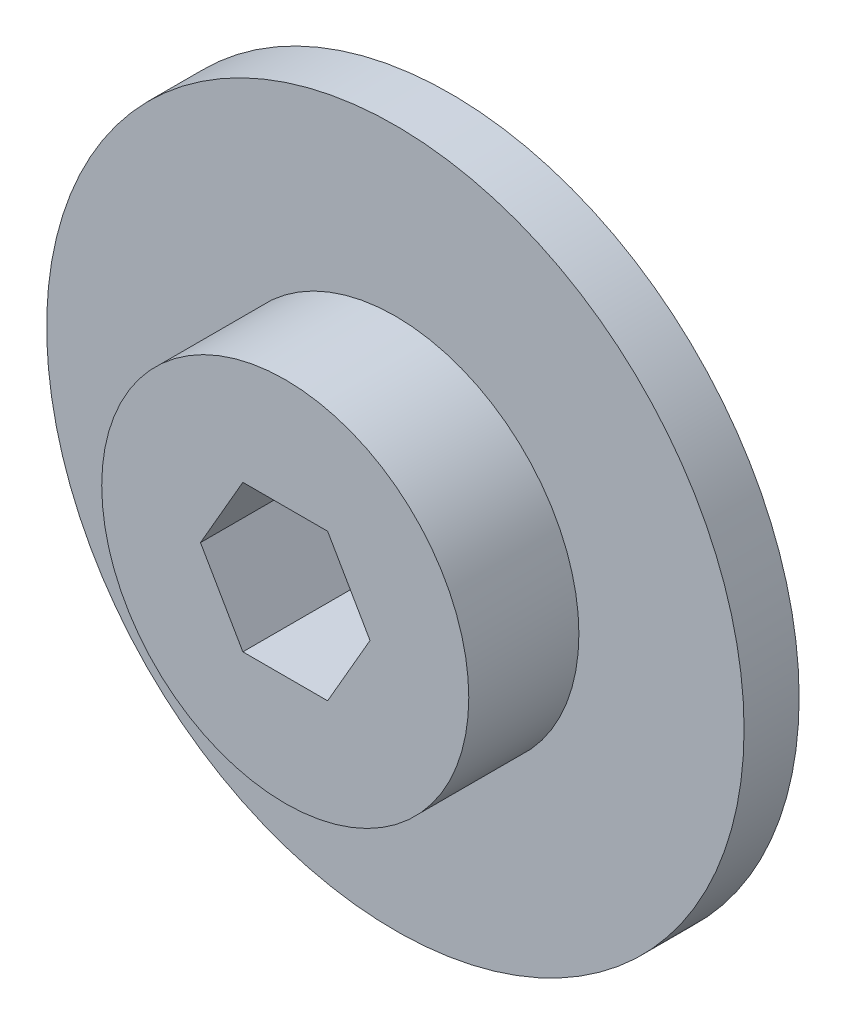
from build123d import *

# Parameters (mm, degrees)
SKETCH_1_R          = 9.5
EXTRUDE_1_DEPTH     = 1.5
SKETCH_2_R          = 5
EXTRUDE_2_DEPTH     = 3
CUT_EXTRUDE_1_DEPTH = 3


with BuildPart() as part:
    # 草图1 → 凸台-拉伸1 (new body)
    with BuildSketch(Plane.XY):
        Circle(SKETCH_1_R)
    extrude(amount=EXTRUDE_1_DEPTH)

    # 草图2 → 凸台-拉伸2 (add)
    with BuildSketch(Plane.XY.offset(1.5)):
        Circle(SKETCH_2_R)
    extrude(amount=EXTRUDE_2_DEPTH)

    # 草图3 → 切除-拉伸1 (cut)
    with BuildSketch(Plane.XY.offset(4.5)):
        Polygon((1.154700538, 2), (-1.154700538, 2), (-2.309401077, 0), (-1.154700538, -2), (1.154700538, -2), (2.309401077, 0), align=None)
    extrude(amount=-CUT_EXTRUDE_1_DEPTH, mode=Mode.SUBTRACT)


solid = part.part
